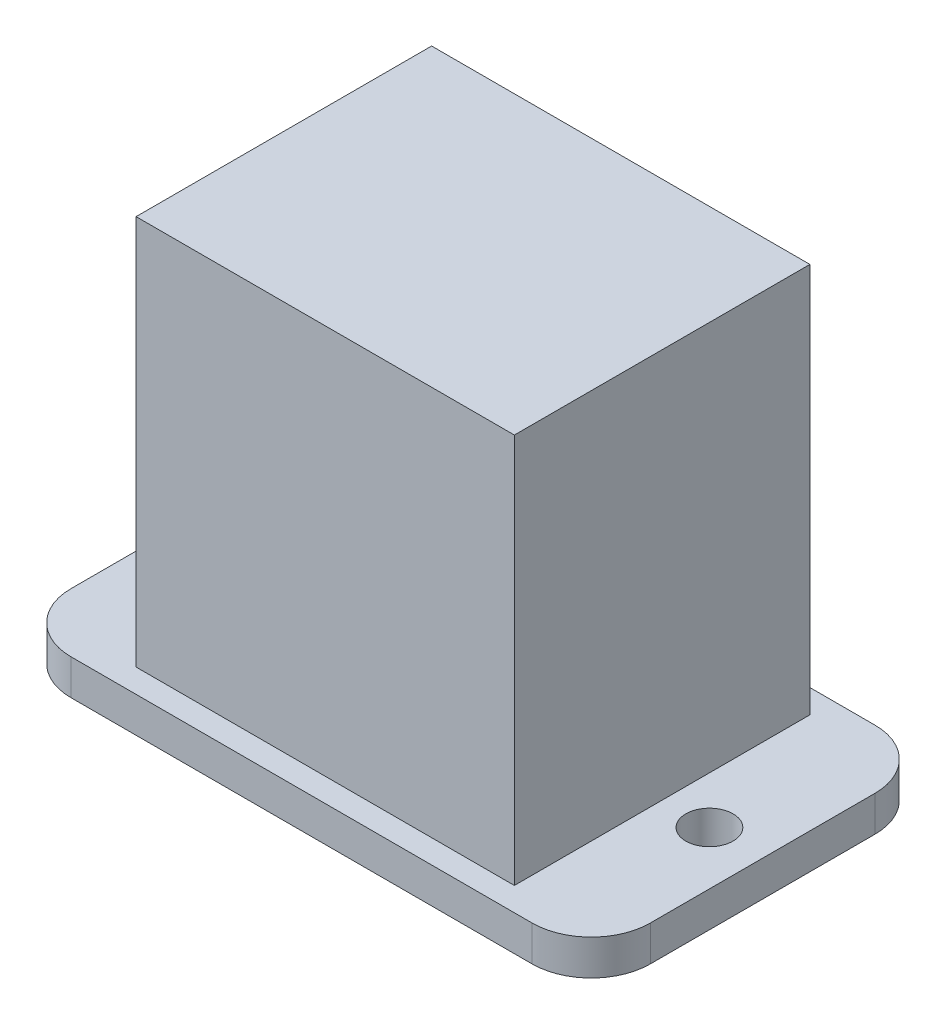
from build123d import *

# Parameters (mm, degrees)
SKETCH1_R           = 2
BOSS_EXTRUDE1_DEPTH = 3
SKETCH2_W           = 32
SKETCH2_H           = 25
BOSS_EXTRUDE2_DEPTH = 33


with BuildPart() as part:
    # Sketch1 → Boss-Extrude1 (new body)
    with BuildSketch(Plane(origin=(0, 0, 0), x_dir=(1, 0, 0), z_dir=(0, 1, 0))):
        with BuildLine():
            Line((5, 0), (44, 0))
            ThreePointArc((44, 0), (47.535533906, 1.464466094), (49, 5))
            Line((49, 5), (49, 24))
            ThreePointArc((49, 24), (47.535533906, 27.535533906), (44, 29))
            Line((44, 29), (5, 29))
            ThreePointArc((5, 29), (1.464466094, 27.535533906), (0, 24))
            Line((0, 24), (0, 5))
            ThreePointArc((0, 5), (1.464466094, 1.464466094), (5, 0))
        make_face()
        with Locations(Location((4.5, 14.5, 0), (0, 0, 270))):
            Circle(SKETCH1_R, mode=Mode.SUBTRACT)
        with Locations(Location((44.5, 14.5, 0), (0, 0, 270))):
            Circle(SKETCH1_R, mode=Mode.SUBTRACT)
    extrude(amount=BOSS_EXTRUDE1_DEPTH)

    # Sketch2 → Boss-Extrude2 (add)
    with BuildSketch(Plane(origin=(0, 3, 0), x_dir=(1, 0, 0), z_dir=(0, 1, 0))):
        with Locations((24.5, 14.5)):
            Rectangle(SKETCH2_W, SKETCH2_H)
    extrude(amount=BOSS_EXTRUDE2_DEPTH)


solid = part.part
